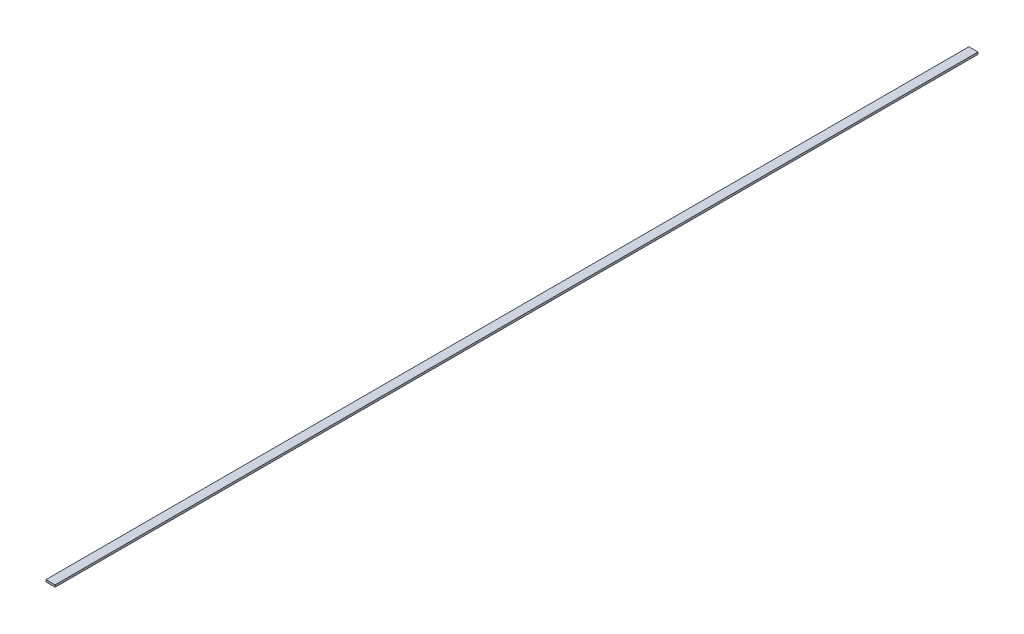
from build123d import *

# Parameters (mm, degrees)
SKETCH1_W           = 2.999994
SKETCH1_H           = 0.700024
BOSS_EXTRUDE1_DEPTH = 304.8


with BuildPart() as part:
    # Sketch1 → Boss-Extrude1 (new body)
    with BuildSketch(Plane.XY):
        Rectangle(SKETCH1_W, SKETCH1_H)
    extrude(amount=BOSS_EXTRUDE1_DEPTH)


solid = part.part
